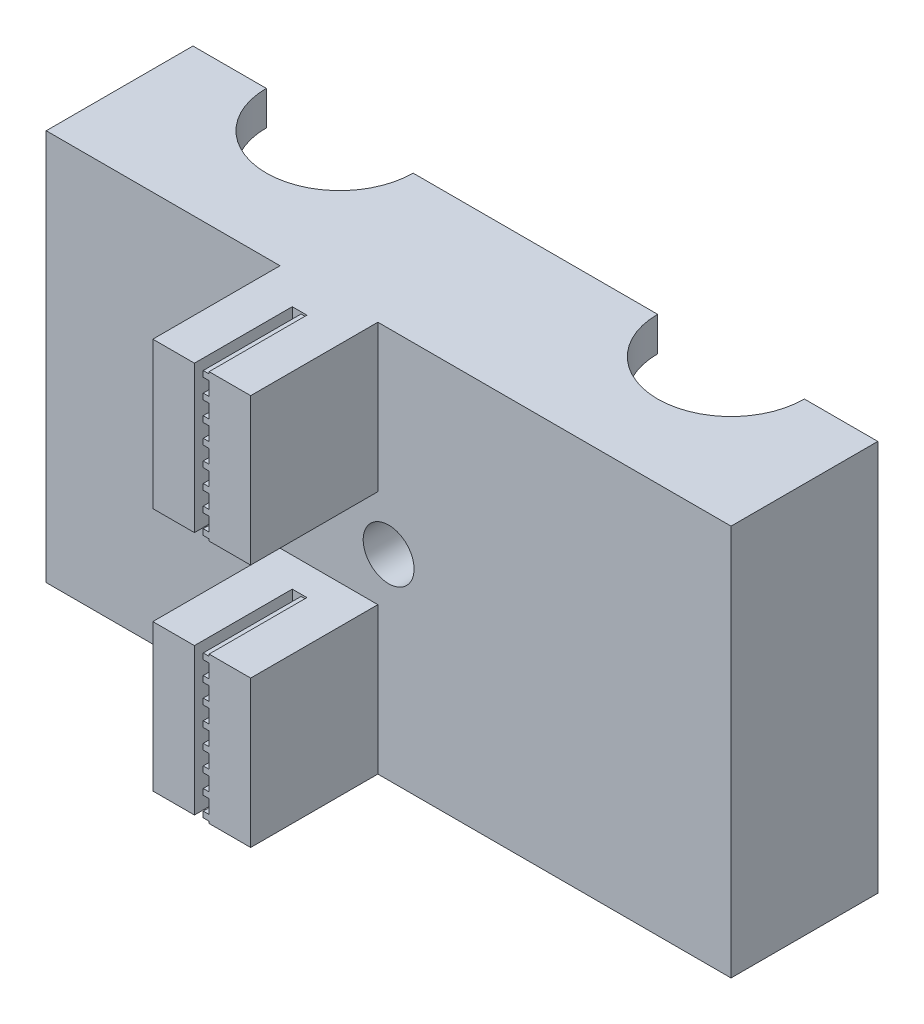
from build123d import *

# Parameters (mm, degrees)
SKETCH1_W           = 70
SKETCH1_H           = 40
BOSS_EXTRUDE1_DEPTH = 15
SKETCH2_R           = 7.5
CUT_EXTRUDE1_DEPTH  = 56.226805086
SKETCH3_R           = 11.5
CUT_EXTRUDE2_DEPTH  = 16.5
SKETCH4_R           = 2.6
CUT_EXTRUDE3_DEPTH  = 44.011626335
SKETCH5_W           = 10
SKETCH5_H           = 15
BOSS_EXTRUDE2_DEPTH = 3
SKETCH8_W           = 4.25
SKETCH8_H           = 15
BOSS_EXTRUDE5_DEPTH = 10
SKETCH9_W           = 0.6
SKETCH9_H           = 0.6
BOSS_EXTRUDE6_DEPTH = 10


with BuildPart() as part:
    # Sketch1 → Boss-Extrude1 (new body)
    with BuildSketch(Plane.XY):
        Rectangle(SKETCH1_W, SKETCH1_H)
    extrude(amount=BOSS_EXTRUDE1_DEPTH)

    # Sketch2 → Cut-Extrude1 (cut, through all)
    with BuildSketch(Plane.XZ.offset(20)):
        with Locations((-20, 0)):
            Circle(SKETCH2_R)
        with Locations((20, 0)):
            Circle(SKETCH2_R)
    extrude(amount=-CUT_EXTRUDE1_DEPTH, mode=Mode.SUBTRACT)

    # Sketch3 → Cut-Extrude2 (cut, symmetric)
    with BuildSketch(Plane(origin=(0, 0, 0), x_dir=(1, 0, 0), z_dir=(0, 1, 0))):
        with Locations((-20, 0)):
            Circle(SKETCH3_R)
        with Locations((20, 0)):
            Circle(SKETCH3_R)
    extrude(amount=CUT_EXTRUDE2_DEPTH, both=True, mode=Mode.SUBTRACT)

    # Sketch4 → Cut-Extrude3 (cut, through all)
    with BuildSketch(Plane.XY.offset(15)):
        Circle(SKETCH4_R)
    extrude(amount=-CUT_EXTRUDE3_DEPTH, mode=Mode.SUBTRACT)

    # Sketch5 → Boss-Extrude2 (add)
    with BuildSketch(Plane.XY.offset(15)):
        with Locations((-6.1, 12.5)):
            Rectangle(SKETCH5_W, SKETCH5_H)
        with Locations((-6.1, -12.5)):
            Rectangle(SKETCH5_W, SKETCH5_H)
    extrude(amount=BOSS_EXTRUDE2_DEPTH)

    # Sketch8 → Boss-Extrude5 (add)
    with BuildSketch(Plane.XY.offset(18)):
        with Locations((-8.975, 12.5)):
            Rectangle(SKETCH8_W, SKETCH8_H)
        with Locations((-3.225, 12.5)):
            Rectangle(SKETCH8_W, SKETCH8_H)
        with Locations((-8.975, -12.5)):
            Rectangle(SKETCH8_W, SKETCH8_H)
        with Locations((-3.225, -12.5)):
            Rectangle(SKETCH8_W, SKETCH8_H)
    extrude(amount=BOSS_EXTRUDE5_DEPTH)

    # Sketch9 → Boss-Extrude6 (add)
    with BuildSketch(Plane.XY.offset(18)):
        with Locations((-5.65, 19.5)):
            Rectangle(SKETCH9_W, SKETCH9_H)
        with Locations((-5.65, 17.5)):
            Rectangle(SKETCH9_W, SKETCH9_H)
        with Locations((-5.65, 15.5)):
            Rectangle(SKETCH9_W, SKETCH9_H)
        with Locations((-5.65, 13.5)):
            Rectangle(SKETCH9_W, SKETCH9_H)
        with Locations((-5.65, 11.5)):
            Rectangle(SKETCH9_W, SKETCH9_H)
        with Locations((-5.65, 9.5)):
            Rectangle(SKETCH9_W, SKETCH9_H)
        with Locations((-5.65, 7.5)):
            Rectangle(SKETCH9_W, SKETCH9_H)
        with Locations((-5.65, 5.5)):
            Rectangle(SKETCH9_W, SKETCH9_H)
        with Locations((-5.65, -19.5)):
            Rectangle(SKETCH9_W, SKETCH9_H)
        with Locations((-5.65, -17.5)):
            Rectangle(SKETCH9_W, SKETCH9_H)
        with Locations((-5.65, -15.5)):
            Rectangle(SKETCH9_W, SKETCH9_H)
        with Locations((-5.65, -13.5)):
            Rectangle(SKETCH9_W, SKETCH9_H)
        with Locations((-5.65, -11.5)):
            Rectangle(SKETCH9_W, SKETCH9_H)
        with Locations((-5.65, -9.5)):
            Rectangle(SKETCH9_W, SKETCH9_H)
        with Locations((-5.65, -7.5)):
            Rectangle(SKETCH9_W, SKETCH9_H)
        with Locations((-5.65, -5.5)):
            Rectangle(SKETCH9_W, SKETCH9_H)
    extrude(amount=BOSS_EXTRUDE6_DEPTH)


solid = part.part
